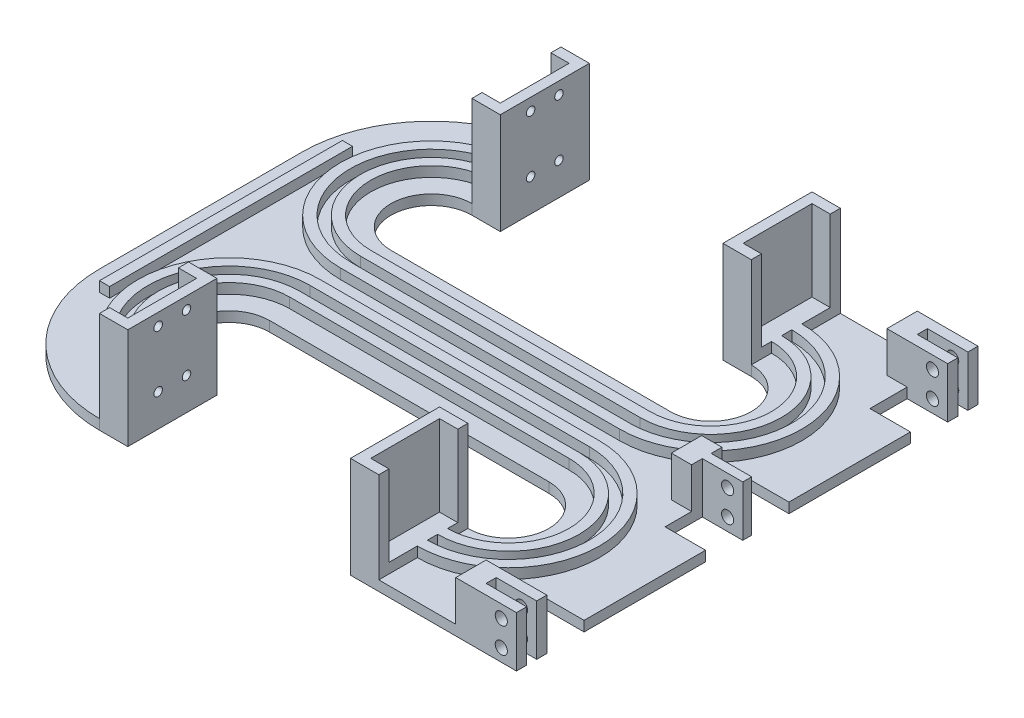
from build123d import *

# Parameters (mm, degrees)
BOSS_EXTRUDE1_DEPTH = 2.5
SKETCH3_W           = 2.5
SKETCH3_H           = 60
BOSS_EXTRUDE2_DEPTH = 2.5
BOSS_EXTRUDE3_DEPTH = 20
SKETCH5_R           = 3.75
BOSS_EXTRUDE4_DEPTH = 5.5
SKETCH6_R           = 3.75
BOSS_EXTRUDE5_DEPTH = 5.5
SKETCH8_R           = 1.05
CUT_EXTRUDE1_DEPTH  = 2.5
SKETCH9_R           = 1.05
CUT_EXTRUDE2_DEPTH  = 2.5
SKETCH10_W          = 5
SKETCH10_H          = 7.5
BOSS_EXTRUDE6_DEPTH = 10
SKETCH11_W          = 2.5
SKETCH11_H          = 12.5
SKETCH11_W_2        = 2.2
BOSS_EXTRUDE7_DEPTH = 10
SKETCH12_R          = 1.5
CUT_EXTRUDE3_DEPTH  = 114
SKETCH14_W          = 30
SKETCH14_H          = 2.5
BOSS_EXTRUDE8_DEPTH = 10


with BuildPart() as part:
    # Sketch1 → Boss-Extrude1 (new body)
    with BuildSketch(Plane(origin=(0, 0, 0), x_dir=(1, 0, 0), z_dir=(0, 1, 0))):
        with BuildLine():
            Line((-62.5, 25), (-62.5, -25))
            ThreePointArc((-62.5, -25), (-53.127416998, -47.627416998), (-30.5, -57))
            Line((-30.5, -57), (-23.5, -57))
            Line((-23.5, -57), (-23.5, -35))
            Line((-23.5, -35), (-30.5, -35))
            ThreePointArc((-30.5, -35), (-40.5, -25), (-30.5, -15))
            Line((-30.5, -15), (38.5, -15))
            ThreePointArc((38.5, -15), (48.5, -25), (38.5, -35))
            Line((38.5, -35), (31.5, -35))
            Line((31.5, -35), (31.5, -57))
            Line((31.5, -57), (38.5, -57))
            Line((38.5, -57), (62.5, -57))
            Line((62.5, -57), (62.5, 57))
            Line((62.5, 57), (38.5, 57))
            Line((38.5, 57), (31.5, 57))
            Line((31.5, 57), (31.5, 35))
            Line((31.5, 35), (38.5, 35))
            ThreePointArc((38.5, 35), (48.5, 25), (38.5, 15))
            Line((38.5, 15), (-30.5, 15))
            ThreePointArc((-30.5, 15), (-40.5, 25), (-30.5, 35))
            Line((-30.5, 35), (-23.5, 35))
            Line((-23.5, 35), (-23.5, 57))
            Line((-23.5, 57), (-30.5, 57))
            ThreePointArc((-30.5, 57), (-53.127416998, 47.627416998), (-62.5, 25))
        make_face()
    extrude(amount=BOSS_EXTRUDE1_DEPTH)

    # Sketch3 → Boss-Extrude2 (add)
    # profile 1 of 3: a face of its own
    with BuildSketch(Plane(origin=(0, 2.5, 0), x_dir=(1, 0, 0), z_dir=(0, 1, 0))):
        with BuildLine():
            Line((-30.5, -2.5), (38.5, -2.5))
            ThreePointArc((38.5, -2.5), (61, -25), (38.5, -47.5))
            Line((38.5, -47.5), (38.5, -57))
            Line((38.5, -57), (31.5, -57))
            Line((31.5, -57), (31.5, -35))
            Line((31.5, -35), (38.5, -35))
            Line((38.5, -35), (38.5, -40))
            ThreePointArc((38.5, -40), (53.5, -25), (38.5, -10))
            Line((38.5, -10), (-30.5, -10))
            ThreePointArc((-30.5, -10), (-45.5, -25), (-30.5, -40))
            Line((-30.5, -40), (-30.5, -35))
            Line((-30.5, -35), (-23.5, -35))
            Line((-23.5, -35), (-23.5, -57))
            Line((-23.5, -57), (-30.5, -57))
            Line((-30.5, -57), (-30.5, -47.5))
            ThreePointArc((-30.5, -47.5), (-53, -25), (-30.5, -2.5))
        make_face()
        with BuildLine():
            Line((-30.5, -5), (38.5, -5))
            ThreePointArc((38.5, -5), (58.5, -25), (38.5, -45))
            Line((38.5, -45), (38.5, -42.5))
            ThreePointArc((38.5, -42.5), (56, -25), (38.5, -7.5))
            Line((38.5, -7.5), (-30.5, -7.5))
            ThreePointArc((-30.5, -7.5), (-48, -25), (-30.5, -42.5))
            Line((-30.5, -42.5), (-30.5, -45))
            ThreePointArc((-30.5, -45), (-50.5, -25), (-30.5, -5))
        make_face(mode=Mode.SUBTRACT)
    # profile 2 of 3: a face of its own
    with BuildSketch(Plane(origin=(0, 2.5, 0), x_dir=(1, 0, 0), z_dir=(0, 1, 0))):
        with Locations((-56.25, 0)):
            Rectangle(SKETCH3_W, SKETCH3_H)
    # profile 3 of 3: a face of its own
    with BuildSketch(Plane(origin=(0, 2.5, 0), x_dir=(1, 0, 0), z_dir=(0, 1, 0))):
        with BuildLine():
            Line((-30.5, 47.5), (-30.5, 57))
            Line((-30.5, 57), (-23.5, 57))
            Line((-23.5, 57), (-23.5, 35))
            Line((-23.5, 35), (-30.5, 35))
            Line((-30.5, 35), (-30.5, 40))
            ThreePointArc((-30.5, 40), (-45.5, 25), (-30.5, 10))
            Line((-30.5, 10), (38.5, 10))
            ThreePointArc((38.5, 10), (53.5, 25), (38.5, 40))
            Line((38.5, 40), (38.5, 35))
            Line((38.5, 35), (31.5, 35))
            Line((31.5, 35), (31.5, 57))
            Line((31.5, 57), (38.5, 57))
            Line((38.5, 57), (38.5, 47.5))
            ThreePointArc((38.5, 47.5), (61, 25), (38.5, 2.5))
            Line((38.5, 2.5), (-30.5, 2.5))
            ThreePointArc((-30.5, 2.5), (-53, 25), (-30.5, 47.5))
        make_face()
        with BuildLine():
            Line((-30.5, 42.5), (-30.5, 45))
            ThreePointArc((-30.5, 45), (-50.5, 25), (-30.5, 5))
            Line((-30.5, 5), (38.5, 5))
            ThreePointArc((38.5, 5), (58.5, 25), (38.5, 45))
            Line((38.5, 45), (38.5, 42.5))
            ThreePointArc((38.5, 42.5), (56, 25), (38.5, 7.5))
            Line((38.5, 7.5), (-30.5, 7.5))
            ThreePointArc((-30.5, 7.5), (-48, 25), (-30.5, 42.5))
        make_face(mode=Mode.SUBTRACT)
    extrude(amount=BOSS_EXTRUDE2_DEPTH)

    # Sketch4 → Boss-Extrude3 (add)
    with BuildSketch(Plane(origin=(0, 5, 0), x_dir=(1, 0, 0), z_dir=(0, 1, 0))):
        Polygon((-30.5, -35), (-23.5, -35), (-23.5, -57), (-30.5, -57), (-30.5, -54.5), (-26, -54.5), (-26, -37.5), (-30.5, -37.5), align=None)
        Polygon((38.5, -35), (31.5, -35), (31.5, -57), (38.5, -57), (38.5, -54.5), (34, -54.5), (34, -37.5), (38.5, -37.5), align=None)
        Polygon((38.5, 37.5), (38.5, 35), (31.5, 35), (31.5, 57), (38.5, 57), (38.5, 54.5), (34, 54.5), (34, 37.5), align=None)
        Polygon((-30.5, 37.5), (-30.5, 35), (-23.5, 35), (-23.5, 57), (-30.5, 57), (-30.5, 54.5), (-26, 54.5), (-26, 37.5), align=None)
    extrude(amount=BOSS_EXTRUDE3_DEPTH)

    # Sketch5 → Boss-Extrude4 (add)
    with BuildSketch(Plane.ZY.offset(-31.5)):
        with Locations(Location((46, 12.5, 0), (0, 0, 180))):
            Circle(SKETCH5_R)
    extrude(amount=BOSS_EXTRUDE4_DEPTH)

    # Sketch6 → Boss-Extrude5 (add)
    with BuildSketch(Plane.ZY.offset(-31.5)):
        with Locations(Location((-46, 12.5, 0), (0, 0, 180))):
            Circle(SKETCH6_R)
    extrude(amount=BOSS_EXTRUDE5_DEPTH)

    # Sketch8 → Cut-Extrude1 (cut)
    with BuildSketch(Plane(origin=(-23.5, 0, 0), x_dir=(0, 0, -1), z_dir=(1, 0, 0))):
        with Locations((-42.5, 22)):
            Circle(SKETCH8_R)
        with Locations(Location((-49.5, 22, 0), (0, 0, 180))):
            Circle(SKETCH8_R)
        with Locations((-49.5, 8)):
            Circle(SKETCH8_R)
        with Locations(Location((-42.5, 8, 0), (0, 0, 180))):
            Circle(SKETCH8_R)
    extrude(amount=-CUT_EXTRUDE1_DEPTH, mode=Mode.SUBTRACT)

    # Sketch9 → Cut-Extrude2 (cut)
    with BuildSketch(Plane(origin=(-23.5, 0, 0), x_dir=(0, 0, -1), z_dir=(1, 0, 0))):
        with Locations((49.5, 22)):
            Circle(SKETCH9_R)
        with Locations(Location((42.5, 22, 0), (0, 0, 180))):
            Circle(SKETCH9_R)
        with Locations((42.5, 8)):
            Circle(SKETCH9_R)
        with Locations(Location((49.5, 8, 0), (0, 0, 180))):
            Circle(SKETCH9_R)
    extrude(amount=-CUT_EXTRUDE2_DEPTH, mode=Mode.SUBTRACT)

    # Sketch10 → Boss-Extrude6 (add)
    with BuildSketch(Plane(origin=(0, 2.5, 0), x_dir=(1, 0, 0), z_dir=(0, 1, 0))):
        with Locations((60, 53.25)):
            Rectangle(SKETCH10_W, SKETCH10_H)
        with Locations((60, 0)):
            Rectangle(SKETCH10_W, SKETCH10_H)
        with Locations((60, -53.25)):
            Rectangle(SKETCH10_W, SKETCH10_H)
    extrude(amount=BOSS_EXTRUDE6_DEPTH)

    # Sketch11 → Boss-Extrude7 (add)
    with BuildSketch(Plane(origin=(62.5, 0, 0), x_dir=(0, 0, -1), z_dir=(1, 0, 0))):
        with Locations((55.75, 6.25)):
            Rectangle(SKETCH11_W, SKETCH11_H)
        with Locations((0, 6.25)):
            Rectangle(SKETCH11_W_2, SKETCH11_H)
        with Locations((50.75, 6.25)):
            Rectangle(SKETCH11_W, SKETCH11_H)
        with Locations((-50.75, 6.25)):
            Rectangle(SKETCH11_W, SKETCH11_H)
        with Locations((-55.75, 6.25)):
            Rectangle(SKETCH11_W, SKETCH11_H)
    extrude(amount=BOSS_EXTRUDE7_DEPTH)

    # Sketch12 → Cut-Extrude3 (cut)
    with BuildSketch(Plane(origin=(0, 0, -57), x_dir=(-1, 0, 0), z_dir=(0, 0, -1))):
        with Locations((-68.75, 9.375)):
            Circle(SKETCH12_R)
        with Locations((-68.75, 3.125)):
            Circle(SKETCH12_R)
    extrude(amount=-CUT_EXTRUDE3_DEPTH, mode=Mode.SUBTRACT)

    # Sketch14 → Boss-Extrude8 (add)
    with BuildSketch(Plane(origin=(62.5, 0, 0), x_dir=(0, 0, -1), z_dir=(1, 0, 0))):
        with Locations((-25.3, 1.25)):
            Rectangle(SKETCH14_W, SKETCH14_H)
        with Locations((25.3, 1.25)):
            Rectangle(SKETCH14_W, SKETCH14_H)
    extrude(amount=BOSS_EXTRUDE8_DEPTH)


solid = part.part
